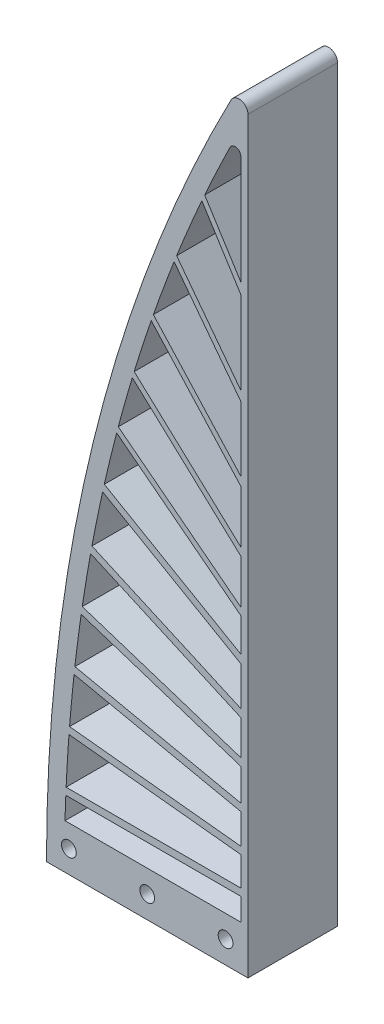
from build123d import *

# Parameters (mm, degrees)
BOSS_EXTRUDE4_DEPTH = 20
BOSS_EXTRUDE7_START = -20
BOSS_EXTRUDE7_DEPTH = 20
SKETCH12_R          = 1.65
CUT_EXTRUDE1_DEPTH  = 177.068006068


with BuildPart() as part:
    # Sketch5 → Boss-Extrude4 (new body)
    with BuildSketch(Plane.XY):
        with BuildLine():
            Line((0, 0), (0, 167.041245738))
            ThreePointArc((0, 167.041245738), (-1.523254023, 168.9835931), (-3.772713274, 167.967252028))
            ThreePointArc((-3.772713274, 167.967252028), (-34.542452011, 86.476422979), (-45, 0))
            Line((-45, 0), (0, 0))
        make_face()
        with BuildLine():
            Line((-1.6, 10), (-40.860610891, 10))
            ThreePointArc((-40.860610891, 10), (-30.458147518, 86.332115465), (-4, 158.683822602))
            ThreePointArc((-4, 158.683822602), (-2.577933762, 159.356407939), (-1.6, 158.124219244))
            Line((-1.6, 158.124219244), (-1.6, 10))
        make_face(mode=Mode.SUBTRACT)
    extrude(amount=BOSS_EXTRUDE4_DEPTH)

    # Sketch11 → Boss-Extrude7 (add)
    with BuildSketch(Plane.XY.offset(20).offset(BOSS_EXTRUDE7_START)):
        with BuildLine():
            ThreePointArc((-40.61576824, 16.6), (-40.651926046, 15.800039355), (-40.686298284, 15))
            Line((-40.686298284, 15), (-1.6, 15))
            Line((-1.6, 15), (-1.6, 16.6))
            Line((-1.6, 16.6), (-40.61576824, 16.6))
        make_face()
        with BuildLine():
            ThreePointArc((-39.849641566, 28.707538392), (-39.912786801, 27.909744506), (-39.974152323, 27.111811753))
            Line((-39.974152323, 27.111811753), (-1.6, 23.078525819))
            Line((-1.6, 23.078525819), (-1.6, 24.687339066))
            Line((-1.6, 24.687339066), (-39.849641566, 28.707538392))
        make_face()
        with BuildLine():
            ThreePointArc((-38.660345477, 40.906700159), (-38.751098874, 40.10802838), (-38.840062688, 39.30915528))
            Line((-38.840062688, 39.30915528), (-1.6, 31.393535598))
            Line((-1.6, 31.393535598), (-1.6, 33.02928055))
            Line((-1.6, 33.02928055), (-38.660345477, 40.906700159))
        make_face()
        with BuildLine():
            ThreePointArc((-37.013521794, 53.335050155), (-37.133222882, 52.532613088), (-37.251109088, 51.729907388))
            Line((-37.251109088, 51.729907388), (-1.6, 40.146159853))
            Line((-1.6, 40.146159853), (-1.6, 41.828499411))
            Line((-1.6, 41.828499411), (-37.013521794, 53.335050155))
        make_face()
        with BuildLine():
            ThreePointArc((-34.852060307, 66.133887827), (-35.002794049, 65.325048554), (-35.151672531, 64.515865738))
            Line((-35.151672531, 64.515865738), (-1.6, 49.577698687))
            Line((-1.6, 49.577698687), (-1.6, 51.329116733))
            Line((-1.6, 51.329116733), (-34.852060307, 66.133887827))
        make_face()
        with BuildLine():
            ThreePointArc((-32.092292656, 79.450787546), (-32.27693125, 78.633291388), (-32.45965971, 77.815366152))
            Line((-32.45965971, 77.815366152), (-1.6, 59.998533312))
            Line((-1.6, 59.998533312), (-1.6, 61.846054173))
            Line((-1.6, 61.846054173), (-32.092292656, 79.450787546))
        make_face()
        with BuildLine():
            ThreePointArc((-28.966005847, 92.142511062), (-29.146660506, 91.459980039), (-29.325971671, 90.77709483))
            Line((-29.325971671, 90.77709483), (-1.6, 69.30954071))
            Line((-1.6, 69.30954071), (-1.6, 70.953669837))
            Line((-1.6, 70.953669837), (-28.966005847, 92.142511062))
        make_face()
        with BuildLine():
            ThreePointArc((-25.415771616, 104.592932273), (-25.62575353, 103.901436527), (-25.834342161, 103.209519225))
            Line((-25.834342161, 103.209519225), (-1.6, 80.807713123))
            Line((-1.6, 80.807713123), (-1.6, 82.578045531))
            Line((-1.6, 82.578045531), (-25.415771616, 104.592932273))
        make_face()
        with BuildLine():
            ThreePointArc((-21.12443405, 117.757312491), (-21.366950886, 117.057023911), (-21.608020686, 116.356235882))
            Line((-21.608020686, 116.356235882), (-1.6, 94.329309417))
            Line((-1.6, 94.329309417), (-1.6, 96.262768885))
            Line((-1.6, 96.262768885), (-21.12443405, 117.757312491))
        make_face()
        with BuildLine():
            ThreePointArc((-15.938835517, 131.737298585), (-16.21749388, 131.029204139), (-16.49464978, 130.320520265))
            Line((-16.49464978, 130.320520265), (-1.6, 110.733232757))
            Line((-1.6, 110.733232757), (-1.6, 112.880937546))
            Line((-1.6, 112.880937546), (-15.938835517, 131.737298585))
        make_face()
        with BuildLine():
            ThreePointArc((-9.669507991, 146.627994836), (-9.988229593, 145.91414681), (-10.30539498, 145.199605992))
            Line((-10.30539498, 145.199605992), (-1.6, 131.402518814))
            Line((-1.6, 131.402518814), (-1.6, 133.83871813))
            Line((-1.6, 133.83871813), (-9.669507991, 146.627994836))
        make_face()
    extrude(amount=BOSS_EXTRUDE7_DEPTH)

    # Sketch12 → Cut-Extrude1 (cut, through all)
    with BuildSketch(Plane.XY.offset(20)):
        with Locations((-40, 5)):
            Circle(SKETCH12_R)
        with Locations((-22.5, 5)):
            Circle(SKETCH12_R)
        with Locations((-5, 5)):
            Circle(SKETCH12_R)
    extrude(amount=-CUT_EXTRUDE1_DEPTH, mode=Mode.SUBTRACT)


solid = part.part
